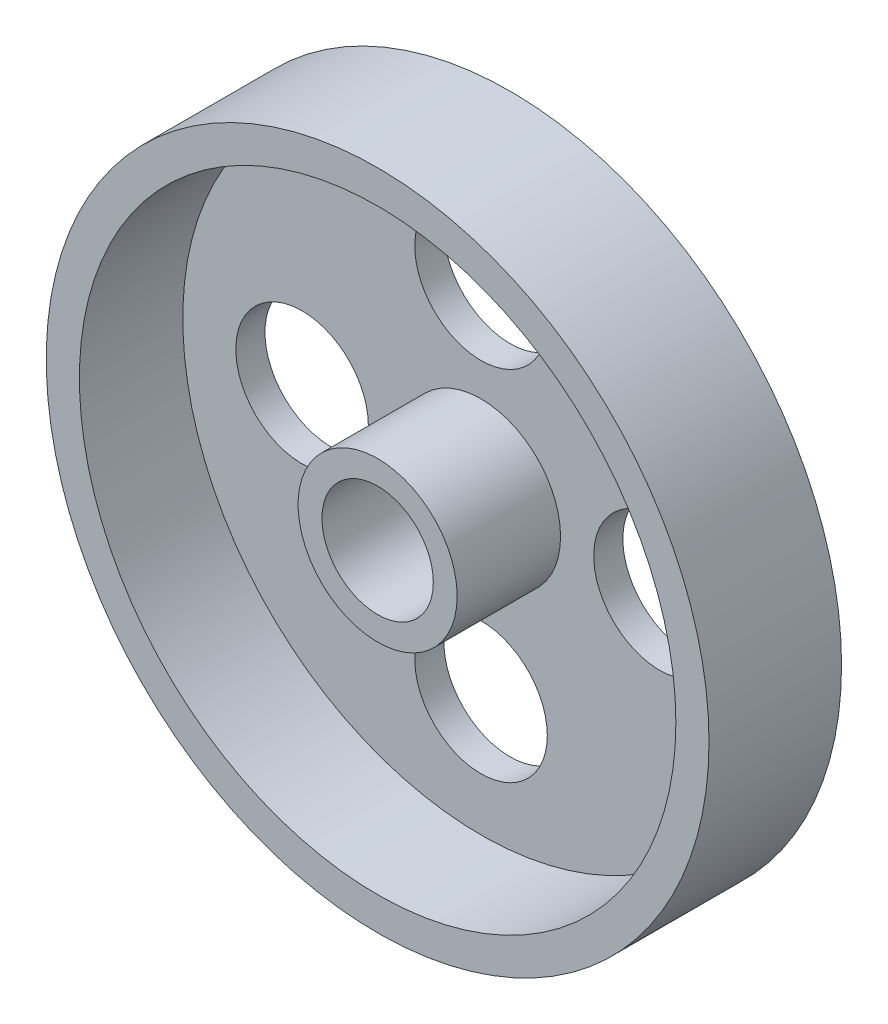
from build123d import *

# Parameters (mm, degrees)
SKETCH1_R                 = 25
WHEEL_WEB_50MM_DEPTH      = 2.2
OUTER_RIM_10MM_WIDE_START = 2.2
SKETCH2_R                 = 25
SKETCH2_R_2               = 22.5
OUTER_RIM_10MM_WIDE_DEPTH = 7.8
HUB_12MM_START            = 2.2
SKETCH3_R                 = 6
HUB_12MM_DEPTH            = 7.8
AXLE_BORE_FIT_CHECK_START = -0.1
SKETCH4_R                 = 4.2
AXLE_BORE_FIT_CHECK_DEPTH = 10.2
LIGHTENING_X_13_5_START   = -0.1
SKETCH5_R                 = 5
LIGHTENING_X_13_5_DEPTH   = 10.2
SKETCH6_R                 = 5
LIGHTENING_X_13_5_2_DEPTH = 10.2
LIGHTENING_Y_13_5_START   = -0.1
SKETCH7_R                 = 5
LIGHTENING_Y_13_5_DEPTH   = 10.2
SKETCH8_R                 = 5
LIGHTENING_Y_13_5_2_DEPTH = 10.2


with BuildPart() as part:
    # Sketch1 → Wheel_Web_50mm (new body)
    with BuildSketch(Plane.XY):
        Circle(SKETCH1_R)
    extrude(amount=WHEEL_WEB_50MM_DEPTH)

    # Sketch2 → Outer_Rim_10mm_Wide (add)
    with BuildSketch(Plane.XY.offset(OUTER_RIM_10MM_WIDE_START)):
        Circle(SKETCH2_R)
        Circle(SKETCH2_R_2, mode=Mode.SUBTRACT)
    extrude(amount=OUTER_RIM_10MM_WIDE_DEPTH)

    # Sketch3 → Hub_12mm (add)
    with BuildSketch(Plane.XY.offset(HUB_12MM_START)):
        Circle(SKETCH3_R)
    extrude(amount=HUB_12MM_DEPTH)

    # Sketch4 → Axle_Bore_FIT_CHECK (cut)
    with BuildSketch(Plane.XY.offset(AXLE_BORE_FIT_CHECK_START)):
        Circle(SKETCH4_R)
    extrude(amount=AXLE_BORE_FIT_CHECK_DEPTH, mode=Mode.SUBTRACT)

    # Sketch5 → Lightening_X_-13.5 (cut)
    with BuildSketch(Plane.XY.offset(LIGHTENING_X_13_5_START)):
        with Locations((-13.5, 0)):
            Circle(SKETCH5_R)
    extrude(amount=LIGHTENING_X_13_5_DEPTH, mode=Mode.SUBTRACT)

    # Sketch6 → Lightening_X_13.5 2 (cut)
    with BuildSketch(Plane.XY.offset(LIGHTENING_X_13_5_START)):
        with Locations((13.5, 0)):
            Circle(SKETCH6_R)
    extrude(amount=LIGHTENING_X_13_5_2_DEPTH, mode=Mode.SUBTRACT)

    # Sketch7 → Lightening_Y_-13.5 (cut)
    with BuildSketch(Plane.XY.offset(LIGHTENING_Y_13_5_START)):
        with Locations((0, -13.5)):
            Circle(SKETCH7_R)
    extrude(amount=LIGHTENING_Y_13_5_DEPTH, mode=Mode.SUBTRACT)

    # Sketch8 → Lightening_Y_13.5 2 (cut)
    with BuildSketch(Plane.XY.offset(LIGHTENING_Y_13_5_START)):
        with Locations((0, 13.5)):
            Circle(SKETCH8_R)
    extrude(amount=LIGHTENING_Y_13_5_2_DEPTH, mode=Mode.SUBTRACT)


solid = part.part
